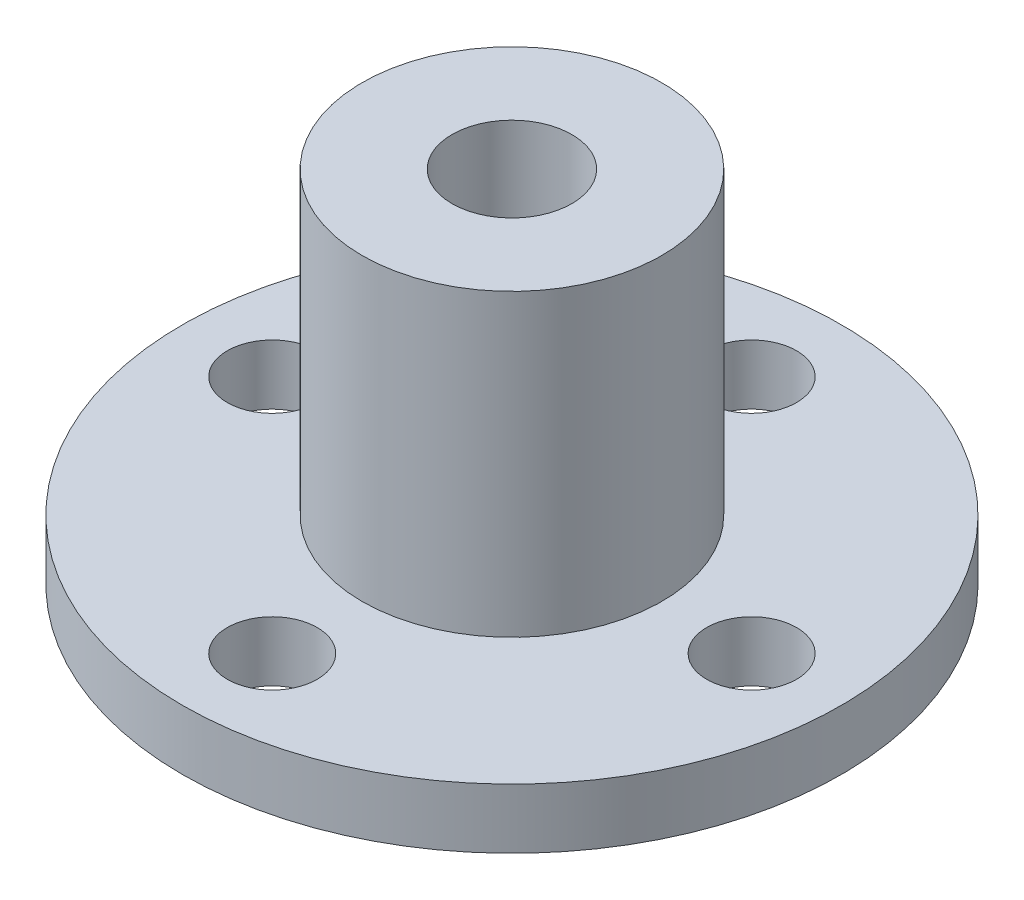
from build123d import *

# Parameters (mm, degrees)
SKETCH1_R           = 11
BOSS_EXTRUDE1_DEPTH = 2
SKETCH2_R           = 5
BOSS_EXTRUDE2_DEPTH = 10
SKETCH3_R           = 2
CUT_EXTRUDE1_DEPTH  = 20.646882704
SKETCH4_R           = 1.5
CUT_EXTRUDE2_DEPTH  = 19.493242009
CIRPATTERN1_COUNT   = 4


with BuildPart() as part:
    # Sketch1 → Boss-Extrude1 (new body)
    with BuildSketch(Plane(origin=(0, 0, 0), x_dir=(1, 0, 0), z_dir=(0, 1, 0))):
        with Locations(Location((0, 0, 0), (0, 0, 270))):
            Circle(SKETCH1_R)
    extrude(amount=BOSS_EXTRUDE1_DEPTH)

    # Sketch2 → Boss-Extrude2 (add)
    with BuildSketch(Plane(origin=(0, 2, 0), x_dir=(1, 0, 0), z_dir=(0, 1, 0))):
        with Locations(Location((0, 0, 0), (0, 0, 270))):
            Circle(SKETCH2_R)
    extrude(amount=BOSS_EXTRUDE2_DEPTH)

    # Sketch3 → Cut-Extrude1 (cut, through all)
    with BuildSketch(Plane(origin=(0, 12, 0), x_dir=(1, 0, 0), z_dir=(0, 1, 0))):
        with Locations(Location((0, 0, 0), (0, 0, 270))):
            Circle(SKETCH3_R)
    extrude(amount=-CUT_EXTRUDE1_DEPTH, mode=Mode.SUBTRACT)

    # Sketch4 → Cut-Extrude2 (cut, through all)
    with BuildSketch(Plane(origin=(0, 2, 0), x_dir=(1, 0, 0), z_dir=(0, 1, 0))):
        with Locations(Location((-8, 0, 0), (0, 0, 270))):
            Circle(SKETCH4_R)
    cut_extrude2 = extrude(amount=-CUT_EXTRUDE2_DEPTH, mode=Mode.SUBTRACT)

    # CirPattern1: Cut-Extrude2 ×4 about axis
    cirpattern1_axis = Axis((0, 0, 0), (0, 1, 0))
    for i in range(1, CIRPATTERN1_COUNT):
        add(cut_extrude2.rotate(cirpattern1_axis, i * 360 / CIRPATTERN1_COUNT), mode=Mode.SUBTRACT)


solid = part.part
